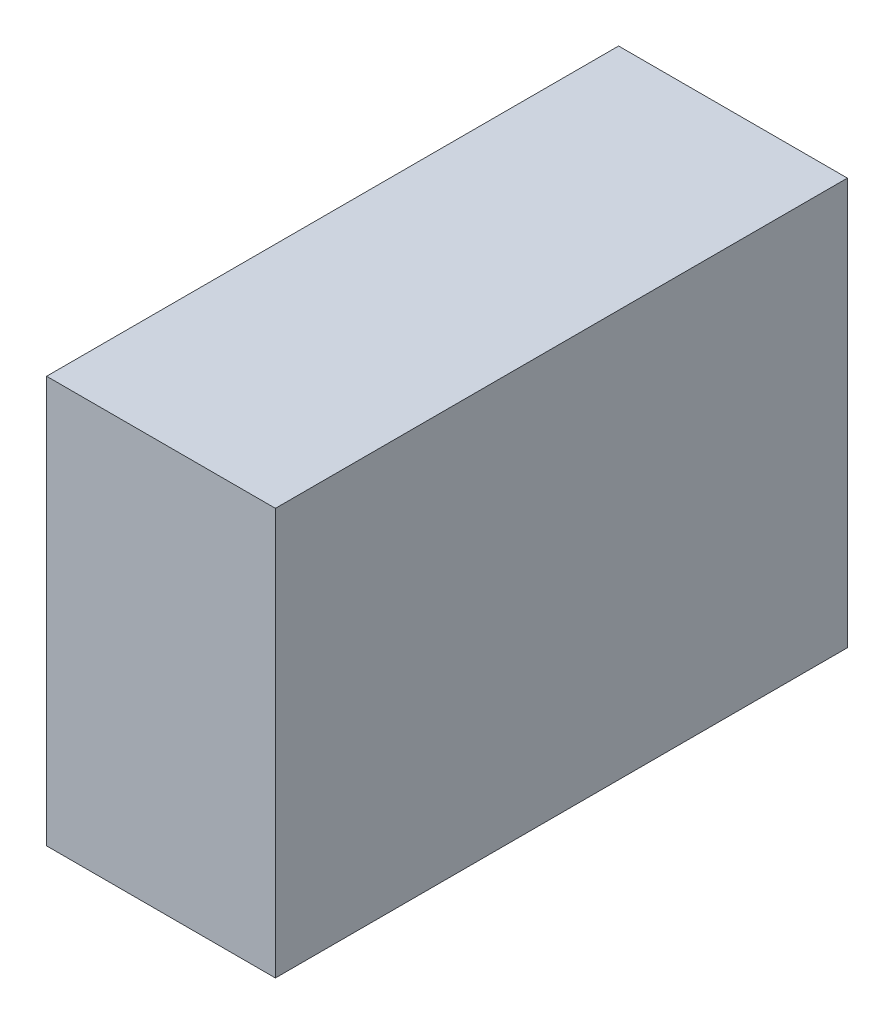
from build123d import *

# Parameters (mm, degrees)
SKETCH1_W           = 28.575
SKETCH1_H           = 71.4375
BOSS_EXTRUDE1_DEPTH = 50.8


with BuildPart() as part:
    # Sketch1 → Boss-Extrude1 (new body)
    with BuildSketch(Plane(origin=(0, 0, 0), x_dir=(1, 0, 0), z_dir=(0, 1, 0))):
        Rectangle(SKETCH1_W, SKETCH1_H)
    extrude(amount=BOSS_EXTRUDE1_DEPTH)


solid = part.part
